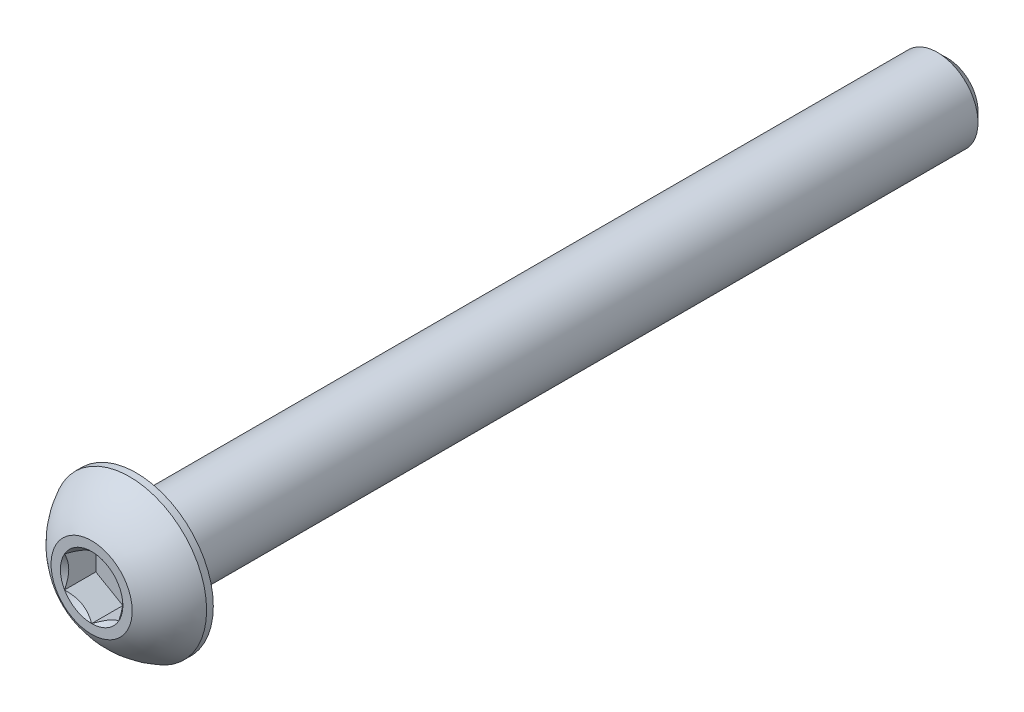
from build123d import *

# Parameters (mm, degrees)
CUT_EXTRUDE2_DEPTH = 1.155


with BuildPart() as part:
    # Sketch10 → Revolve3 (revolve)
    with BuildSketch(Plane(origin=(0, 0, 0), x_dir=(0, 0, -1), z_dir=(1, 0, 0))):
        Polygon((31.275, 1.5), (31.65, 1.125), (31.65, 0), (1.65, 0), (1.65, 1.5), align=None)
    revolve(axis=Axis((0, 0, 0), (0, 0, -1)))

    # Sketch7 → Revolve2 (revolve)
    with BuildSketch(Plane(origin=(0, 0, 0), x_dir=(0, 0, -1), z_dir=(1, 0, 0))):
        with BuildLine():
            Line((1.4025, 2.85), (1.65, 2.85))
            Line((1.65, 2.85), (1.65, 0))
            Line((1.65, 0), (0, 0))
            Line((0, 0), (0, 1.5))
            ThreePointArc((0, 1.5), (0.59512511, 2.285251969), (1.4025, 2.85))
        make_face()
    revolve(axis=Axis((0, 0, 0), (0, 0, -1)))

    # Sketch5 → Cut-Extrude2 (cut)
    with BuildSketch(Plane.XY):
        Polygon((1, -0.577350269), (1, 0.577350269), (0, 1.154700538), (-1, 0.577350269), (-1, -0.577350269), (0, -1.154700538), align=None)
    extrude(amount=-CUT_EXTRUDE2_DEPTH, mode=Mode.SUBTRACT)

    # Cut-Extrude3 cone 1 section (through the dimple's axis) → Cut-Extrude3 (revolve, cut)
    with BuildSketch(Plane(origin=(0, 0, 0), x_dir=(0, -1, 0), z_dir=(1, 0, 0))):
        Polygon((0, 0), (1.154700538, 0), (0, 1.154700538), align=None)
    revolve(axis=Axis((0, 0, 0), (0, 0, -1)), mode=Mode.SUBTRACT)


solid = part.part
